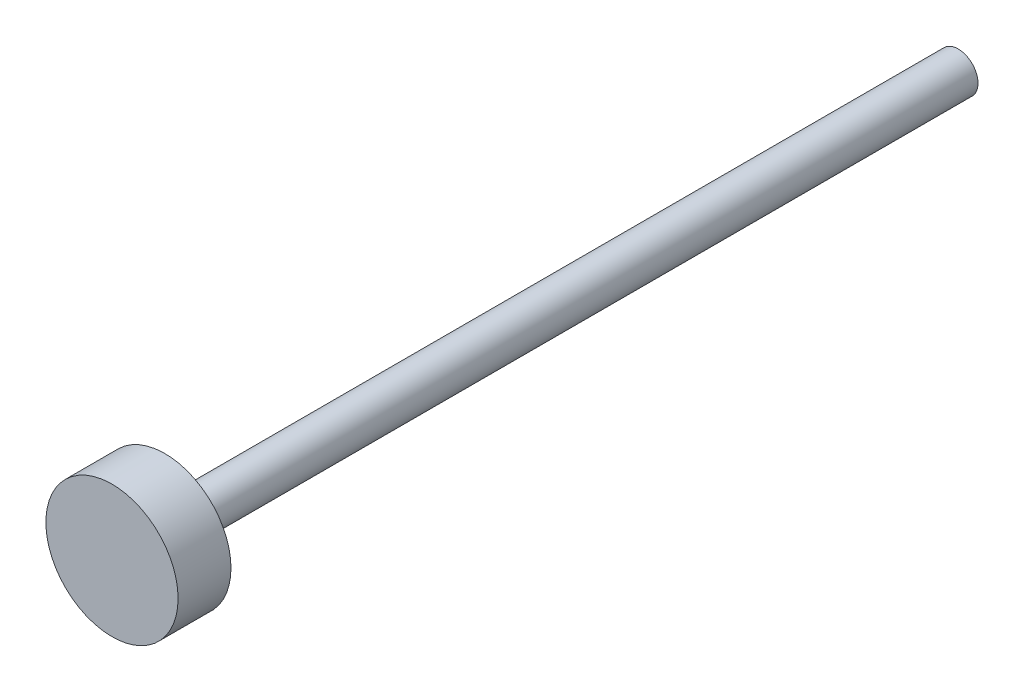
from build123d import *

# Parameters (mm, degrees)
SKETCH_1_R      = 0.75
EXTRUDE_1_DEPTH = 30
SKETCH_2_R      = 2.5
EXTRUDE_2_DEPTH = 2


with BuildPart() as part:
    # 草图1 → 凸台-拉伸1 (new body)
    with BuildSketch(Plane.XY):
        Circle(SKETCH_1_R)
    extrude(amount=EXTRUDE_1_DEPTH)

    # 草图2 → 凸台-拉伸2 (add)
    with BuildSketch(Plane.XY.offset(30)):
        Circle(SKETCH_2_R)
    extrude(amount=EXTRUDE_2_DEPTH)


solid = part.part
